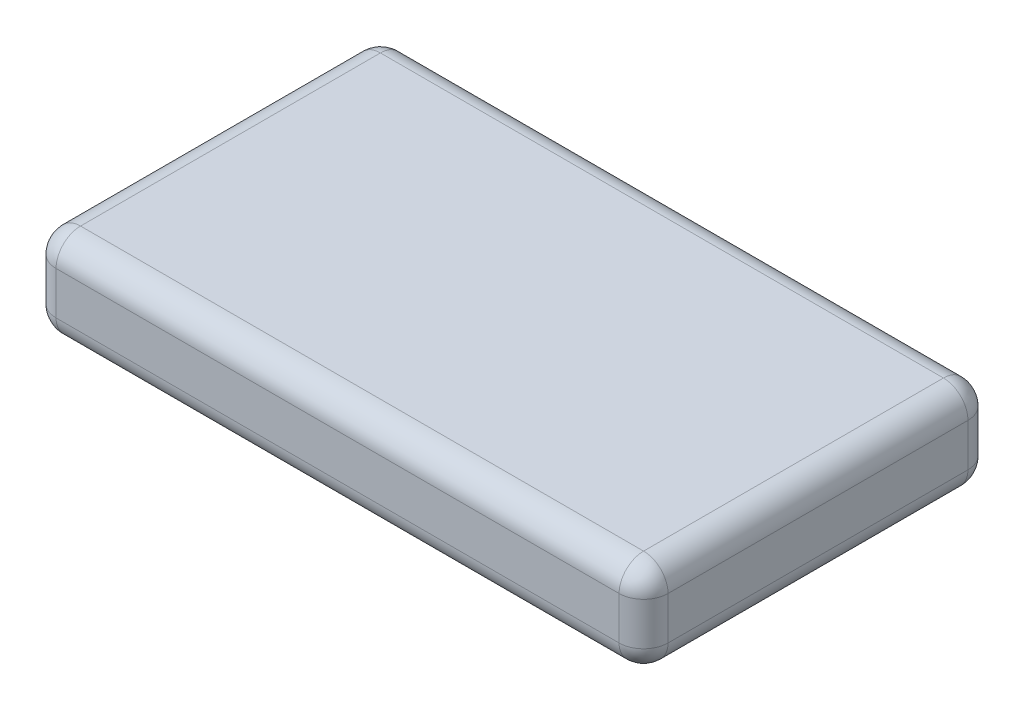
from build123d import *

# Parameters (mm, degrees)
SKETCH1_W           = 50
SKETCH1_H           = 28.5
BOSS_EXTRUDE1_DEPTH = 7.5
FILLET1_R           = 2


with BuildPart() as part:
    # Sketch1 → Boss-Extrude1 (new body)
    with BuildSketch(Plane(origin=(0, 0, 0), x_dir=(1, 0, 0), z_dir=(0, 1, 0))):
        Rectangle(SKETCH1_W, SKETCH1_H)
    extrude(amount=BOSS_EXTRUDE1_DEPTH)

    # Fillet1
    fillet1_edges = [part.edges().sort_by_distance(p)[0] for p in [
        (-25, 7.5, 0),
        (0, 7.5, 14.25),
        (25, 7.5, 0),
        (0, 0, 14.25),
        (-25, 0, 0),
        (0, 0, -14.25),
        (25, 0, 0),
        (0, 7.5, -14.25),
        (25, 3.75, 14.25),
        (-25, 3.75, 14.25),
        (-25, 3.75, -14.25),
        (25, 3.75, -14.25),
    ]]
    fillet(fillet1_edges, radius=FILLET1_R)


solid = part.part
